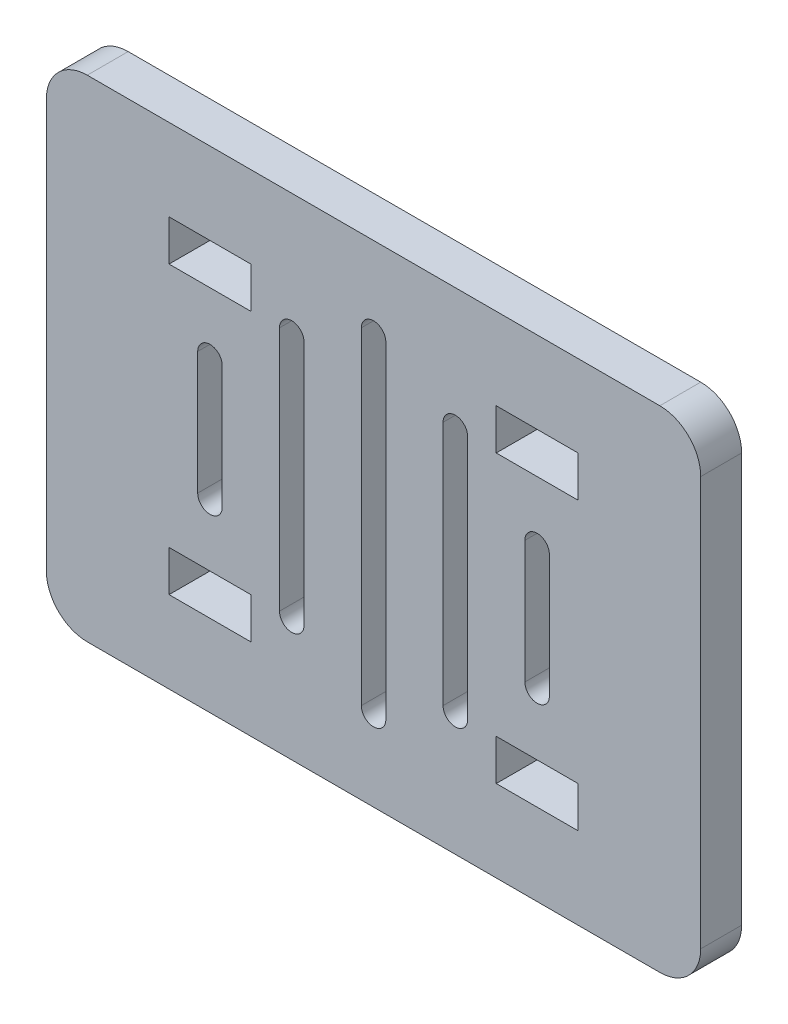
from build123d import *

# Parameters (mm, degrees)
SKETCH1_W           = 5
SKETCH1_H           = 10
BOSS_EXTRUDE1_DEPTH = 2.5
FILLET1_R           = 5


with BuildPart() as part:
    # Sketch1 → Boss-Extrude1 (new, symmetric)
    with BuildSketch(Plane(origin=(0, 0, 0), x_dir=(0, 1, 0), z_dir=(0, 0, 1))):
        Polygon((30, 0), (30, -20), (-30, -20), (-30, 0), (-30, 40), (-30, 60), (30, 60), (30, 40), align=None)
        with Locations((17.5, 0)):
            Rectangle(SKETCH1_W, SKETCH1_H, mode=Mode.SUBTRACT)
        with Locations((17.5, 40)):
            Rectangle(SKETCH1_W, SKETCH1_H, mode=Mode.SUBTRACT)
        with Locations((-17.5, 0)):
            Rectangle(SKETCH1_W, SKETCH1_H, mode=Mode.SUBTRACT)
        with Locations((-17.5, 40)):
            Rectangle(SKETCH1_W, SKETCH1_H, mode=Mode.SUBTRACT)
        with BuildLine():
            Line((7.5, 41.5), (-7.5, 41.5))
            ThreePointArc((-7.5, 41.5), (-9, 40), (-7.5, 38.5))
            Line((-7.5, 38.5), (7.5, 38.5))
            ThreePointArc((7.5, 38.5), (9, 40), (7.5, 41.5))
        make_face(mode=Mode.SUBTRACT)
        with BuildLine():
            Line((15, 31.5), (-15, 31.5))
            ThreePointArc((-15, 31.5), (-16.5, 30), (-15, 28.5))
            Line((-15, 28.5), (15, 28.5))
            ThreePointArc((15, 28.5), (16.5, 30), (15, 31.5))
        make_face(mode=Mode.SUBTRACT)
        with BuildLine():
            Line((20, 21.5), (-20, 21.5))
            ThreePointArc((-20, 21.5), (-21.5, 20), (-20, 18.5))
            Line((-20, 18.5), (20, 18.5))
            ThreePointArc((20, 18.5), (21.5, 20), (20, 21.5))
        make_face(mode=Mode.SUBTRACT)
        with BuildLine():
            Line((15, 11.5), (-15, 11.5))
            ThreePointArc((-15, 11.5), (-16.5, 10), (-15, 8.5))
            Line((-15, 8.5), (15, 8.5))
            ThreePointArc((15, 8.5), (16.5, 10), (15, 11.5))
        make_face(mode=Mode.SUBTRACT)
        with BuildLine():
            Line((7.5, 1.5), (-7.5, 1.5))
            ThreePointArc((-7.5, 1.5), (-9, 0), (-7.5, -1.5))
            Line((-7.5, -1.5), (7.5, -1.5))
            ThreePointArc((7.5, -1.5), (9, 0), (7.5, 1.5))
        make_face(mode=Mode.SUBTRACT)
    extrude(amount=BOSS_EXTRUDE1_DEPTH, both=True)

    # Fillet1
    fillet1_edges = [part.edges().sort_by_distance(p)[0] for p in [
        (-60, -30, 0),
        (-60, 30, 0),
        (20, 30, 0),
        (20, -30, 0),
    ]]
    fillet(fillet1_edges, radius=FILLET1_R)


solid = part.part
